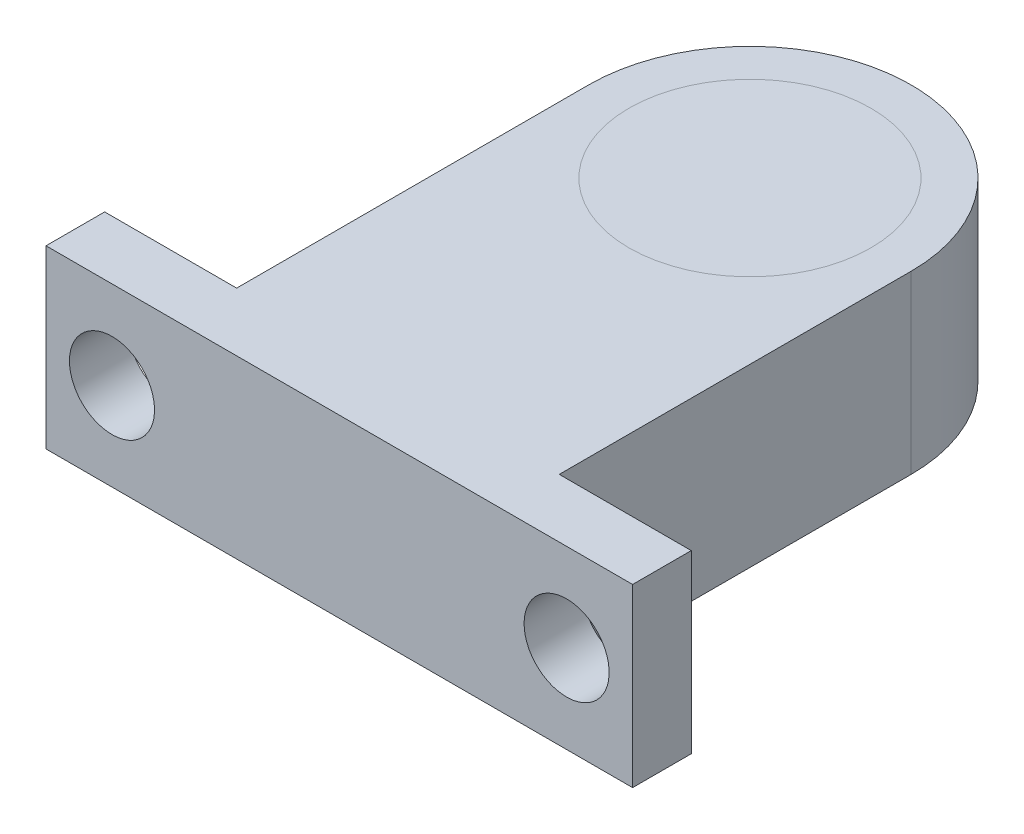
from build123d import *

# Parameters (mm, degrees)
SKETCH1_R                     = 4.125
BOSS_EXTRUDE1_DEPTH           = 6
SKETCH2_W                     = 20
SKETCH2_H                     = 6
BOSS_EXTRUDE2_DEPTH           = 2
TAP_DRILL_FOR_M3_5X0_6_TAP1_D = 2.9
SKETCH5_R                     = 4.125
BOSS_EXTRUDE3_DEPTH           = 0.5


with BuildPart() as part:
    # Sketch1 → Boss-Extrude1 (new body)
    with BuildSketch(Plane(origin=(0, 0, 0), x_dir=(1, 0, 0), z_dir=(0, 1, 0))):
        with BuildLine():
            ThreePointArc((5.5, 0), (0, 5.5), (-5.5, 0))
            Line((-5.5, 0), (-5.5, -12))
            Line((-5.5, -12), (5.5, -12))
            Line((5.5, -12), (5.5, 0))
        make_face()
        Circle(SKETCH1_R, mode=Mode.SUBTRACT)
    extrude(amount=BOSS_EXTRUDE1_DEPTH)

    # Sketch2 → Boss-Extrude2 (add)
    with BuildSketch(Plane.XY.offset(12)):
        with Locations((0, 3)):
            Rectangle(SKETCH2_W, SKETCH2_H)
    extrude(amount=BOSS_EXTRUDE2_DEPTH)

    # Tap Drill for M3.5x0.6 Tap1 (through all)
    with Locations(Plane(origin=(0, 0, 12), x_dir=(-1, 0, 0), z_dir=(0, 0, -1))):
        with Locations((7.75, 3), (-7.75, 3)):
            Hole(TAP_DRILL_FOR_M3_5X0_6_TAP1_D / 2)


with BuildPart() as body_2:
    # Sketch5 → Boss-Extrude3 (new body)
    with BuildSketch(Plane(origin=(0, 6, 0), x_dir=(1, 0, 0), z_dir=(0, 1, 0))):
        Circle(SKETCH5_R)
    extrude(amount=-BOSS_EXTRUDE3_DEPTH)


solid = Compound([part.part, body_2.part])
